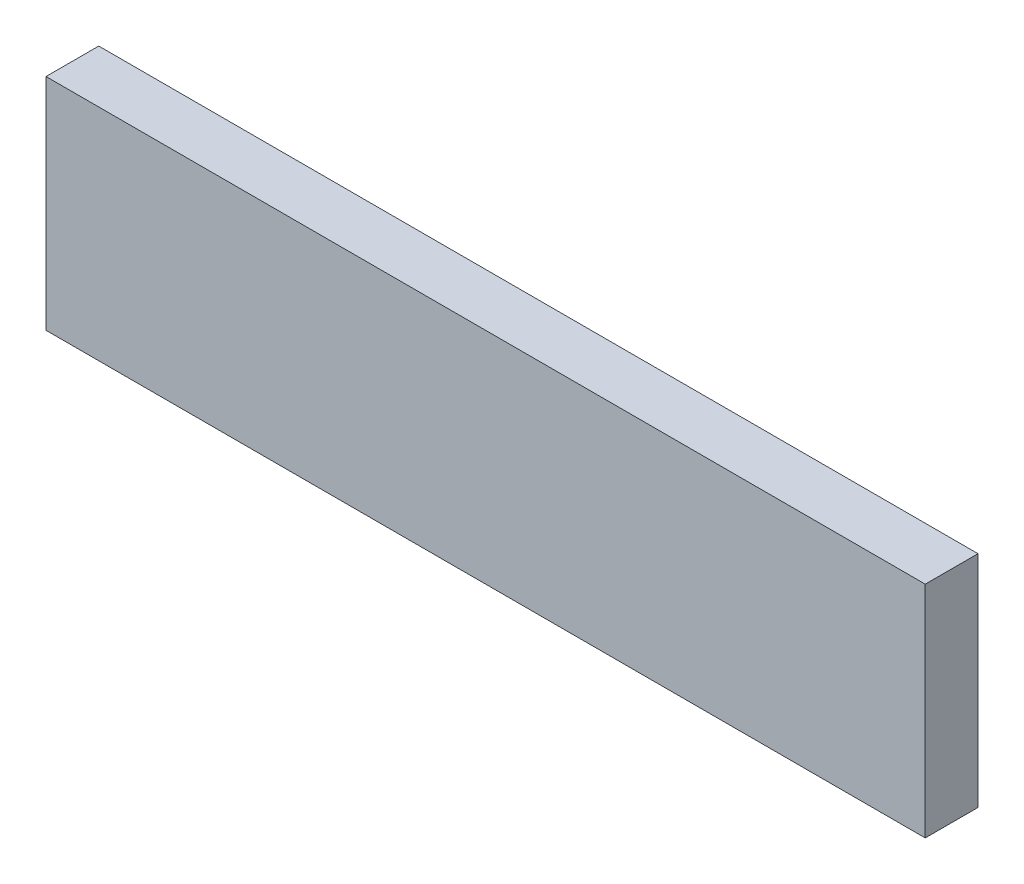
from build123d import *

# Parameters (mm, degrees)
SKETCH1_W           = 100
SKETCH1_H           = 25
BOSS_EXTRUDE1_DEPTH = 6


with BuildPart() as part:
    # Sketch1 → Boss-Extrude1 (new body)
    with BuildSketch(Plane.XY):
        with Locations((-92.857142857, 30.519480519)):
            Rectangle(SKETCH1_W, SKETCH1_H)
    extrude(amount=BOSS_EXTRUDE1_DEPTH)


solid = part.part
